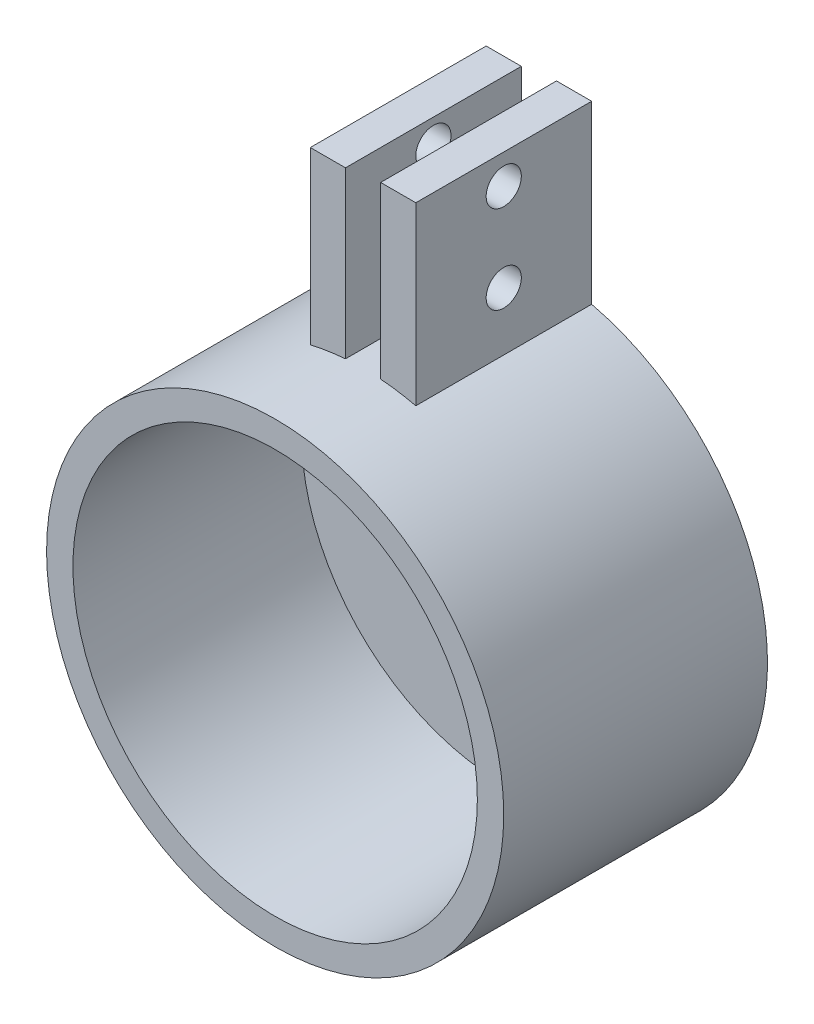
from build123d import *

# Parameters (mm, degrees)
SKETCH5_R               = 13
SKETCH5_R_2             = 11.5
BOSS_EXTRUDE1_DEPTH     = 15
SKETCH6_R               = 13
BOSS_EXTRUDE2_DEPTH     = 2
SKETCH7_W               = 2
SKETCH7_H               = 10
EXTRUDE_THIN1_DEPTH     = 10
SKETCH8_W               = 2
SKETCH8_H               = 9.720206236
EXTRUDE_THIN2_DEPTH     = 10
CUT_EXTRUDE1_DEPTH      = 32.527483452
CUT_EXTRUDE1_DEPTH_BACK = 32.527483452
SKETCH9_R               = 1


with BuildPart() as part:
    # Sketch5 → Boss-Extrude1 (new body)
    with BuildSketch(Plane.XY):
        Circle(SKETCH5_R)
        Circle(SKETCH5_R_2, mode=Mode.SUBTRACT)
    extrude(amount=BOSS_EXTRUDE1_DEPTH)

    # Sketch6 → Boss-Extrude2 (add)
    with BuildSketch(Plane.XY):
        Circle(SKETCH6_R)
    extrude(amount=BOSS_EXTRUDE2_DEPTH)

    # Sketch7 → Extrude-Thin1 (add)
    with BuildSketch(Plane(origin=(0, 0, 0), x_dir=(-1, 0, 0), z_dir=(0, 0, -1))):
        with Locations((-2, 17.649110641)):
            Rectangle(SKETCH7_W, SKETCH7_H)
    extrude(amount=-EXTRUDE_THIN1_DEPTH)

    # Sketch8 → Extrude-Thin2 (add)
    with BuildSketch(Plane(origin=(0, 0, 0), x_dir=(-1, 0, 0), z_dir=(0, 0, -1))):
        with Locations((2, 17.509213759)):
            Rectangle(SKETCH8_W, SKETCH8_H)
    extrude(amount=-EXTRUDE_THIN2_DEPTH)

    # Sketch9 → Cut-Extrude1 (cut, two sides: drawn at the far end of the back side and taken through both)
    with BuildSketch(Plane.ZY.offset(3).offset(-CUT_EXTRUDE1_DEPTH_BACK)):
        with Locations((5, 15.961481397)):
            Circle(SKETCH9_R)
        with Locations((5, 20.961481397)):
            Circle(SKETCH9_R)
    extrude(amount=CUT_EXTRUDE1_DEPTH + CUT_EXTRUDE1_DEPTH_BACK, mode=Mode.SUBTRACT)


solid = part.part
